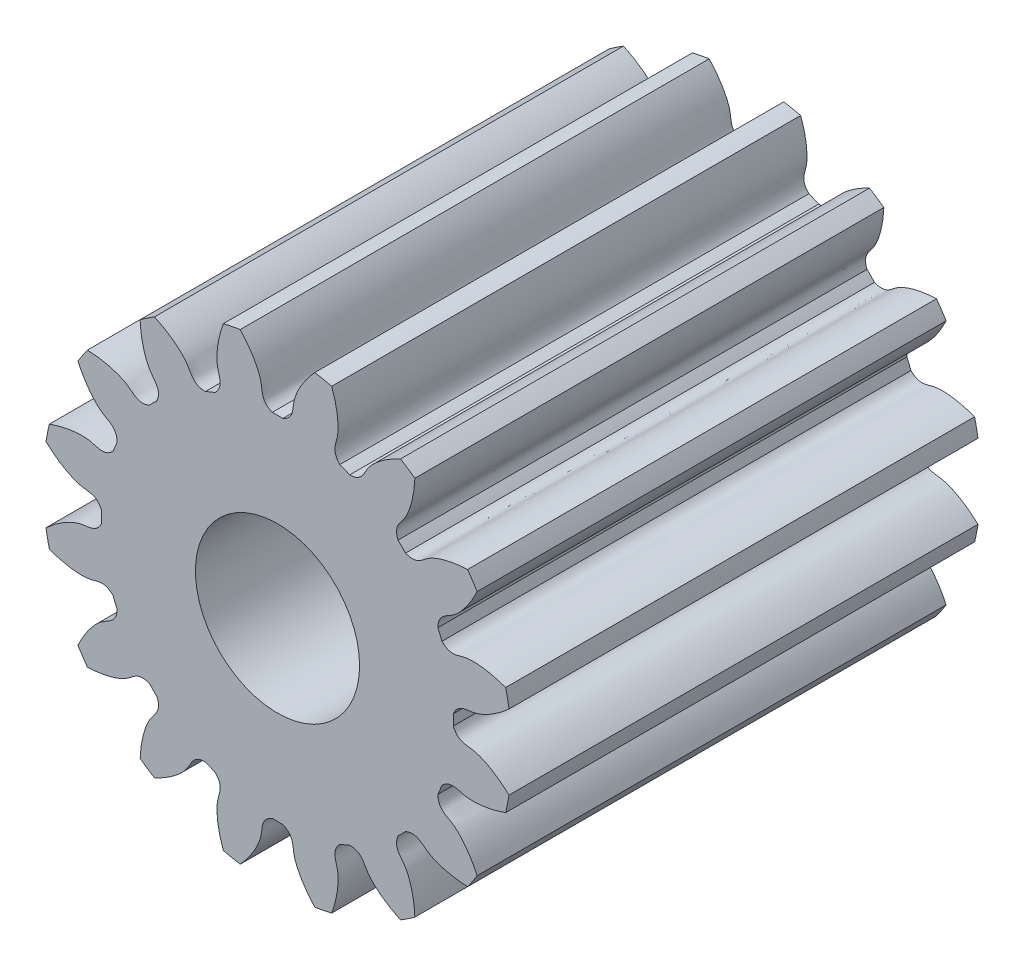
from build123d import *

# Parameters (mm, degrees)
SKETCH_1_R               = 4.5
EXTRUDE_1_DEPTH          = 9
CUT_EXTRUDE_1_DEPTH      = 12.022703843
PATTERN_CIRCULAR_1_COUNT = 16
SKETCH_4_R               = 1.575
CUT_EXTRUDE_2_DEPTH      = 10


with BuildPart() as part:
    # 草图1 → 凸台-拉伸1 (new body)
    with BuildSketch(Plane.XY):
        Circle(SKETCH_1_R)
    extrude(amount=EXTRUDE_1_DEPTH)

    # 草图2 → 切除-拉伸1 (cut, through all)
    with BuildSketch(Plane.XY):
        with BuildLine():
            ThreePointArc((0.101680395, 3.373467963), (0, 3.375), (-0.101680395, 3.373467963))
            add(Edge.make_bspline(
                [(-0.101680395, 3.373467963), (-0.320919735, 3.465061005), (-0.284660598, 3.635349809), (-0.322390644, 3.793404963), (-0.325601394, 3.80577545), (-0.329466049, 3.819526781), (-0.334039479, 3.834637453), (-0.339377888, 3.851083952), (-0.345536205, 3.868841182), (-0.352568839, 3.887882349), (-0.360529384, 3.908179024), (-0.369470654, 3.92970115), (-0.379444617, 3.952417062), (-0.390502356, 3.976293514), (-0.402694025, 4.001295699), (-0.416068812, 4.02738727), (-0.430674889, 4.054530373), (-0.446559381, 4.082685666), (-0.463768319, 4.111812348), (-0.482346604, 4.141868189), (-0.502337967, 4.172809557), (-0.523784931, 4.20459145), (-0.546728776, 4.237167525), (-0.571209498, 4.270490132), (-0.597265778, 4.304510345), (-0.624934946, 4.339177997), (-0.654252942, 4.374441713), (-0.685254293, 4.41024895), (-0.717972069, 4.446546028), (-0.752437861, 4.483278171), (-0.788681746, 4.520389541), (-0.826732258, 4.557823283), (-0.866616358, 4.595521557), (-0.90835941, 4.633425586), (-0.951985152, 4.67147569), (-0.99751567, 4.709611333), (-1.044971373, 4.747771162), (-1.094370973, 4.785893051), (-1.145731456, 4.823914147), (-1.199068069, 4.861770908), (-1.254394289, 4.899399156), (-1.311721817, 4.936734114), (-1.371060539, 4.97371046), (-1.453732402, 5.022959339), (-1.517494148, 5.058370721), (-1.560889991, 5.081371225)],
                knots=[0, 0, 0, 0, 0.200958108, 0.205848205, 0.211390316, 0.217584439, 0.224430575, 0.231928724, 0.240078886, 0.248881062, 0.25833525, 0.268441451, 0.279199665, 0.290609892, 0.302672132, 0.315386384, 0.32875265, 0.342770929, 0.357441221, 0.372763526, 0.388737843, 0.405364174, 0.422642518, 0.440572874, 0.459155244, 0.478389626, 0.498276022, 0.51881443, 0.540004852, 0.561847286, 0.584341734, 0.607488194, 0.631286667, 0.655737153, 0.680839653, 0.706594165, 0.73300069, 0.760059228, 0.787769779, 0.816132343, 0.84514692, 0.87481351, 0.905132113, 0.936102729, 1, 1, 1, 1], degree=3))
            ThreePointArc((-1.560889991, 5.081371225), (0, 5.315704195), (1.560889991, 5.081371225))
            add(Edge.make_bspline(
                [(0.101680395, 3.373467963), (0.320919735, 3.465061005), (0.284660598, 3.635349809), (0.322390644, 3.793404963), (0.325601394, 3.80577545), (0.329466049, 3.819526781), (0.334039479, 3.834637453), (0.339377888, 3.851083952), (0.345536205, 3.868841182), (0.352568839, 3.887882349), (0.360529384, 3.908179024), (0.369470654, 3.92970115), (0.379444617, 3.952417062), (0.390502356, 3.976293514), (0.402694025, 4.001295699), (0.416068812, 4.02738727), (0.430674889, 4.054530373), (0.446559381, 4.082685666), (0.463768319, 4.111812348), (0.482346604, 4.141868189), (0.502337967, 4.172809557), (0.523784931, 4.20459145), (0.546728776, 4.237167525), (0.571209498, 4.270490132), (0.597265778, 4.304510345), (0.624934946, 4.339177997), (0.654252942, 4.374441713), (0.685254293, 4.41024895), (0.717972069, 4.446546028), (0.752437861, 4.483278171), (0.788681746, 4.520389541), (0.826732258, 4.557823283), (0.866616358, 4.595521557), (0.90835941, 4.633425586), (0.951985152, 4.67147569), (0.99751567, 4.709611333), (1.044971373, 4.747771162), (1.094370973, 4.785893051), (1.145731456, 4.823914147), (1.199068069, 4.861770908), (1.254394289, 4.899399156), (1.311721817, 4.936734114), (1.371060539, 4.97371046), (1.453732402, 5.022959339), (1.517494148, 5.058370721), (1.560889991, 5.081371225)],
                knots=[0, 0, 0, 0, 0.200958108, 0.205848205, 0.211390316, 0.217584439, 0.224430575, 0.231928724, 0.240078886, 0.248881062, 0.25833525, 0.268441451, 0.279199665, 0.290609892, 0.302672132, 0.315386384, 0.32875265, 0.342770929, 0.357441221, 0.372763526, 0.388737843, 0.405364174, 0.422642518, 0.440572874, 0.459155244, 0.478389626, 0.498276022, 0.51881443, 0.540004852, 0.561847286, 0.584341734, 0.607488194, 0.631286667, 0.655737153, 0.680839653, 0.706594165, 0.73300069, 0.760059228, 0.787769779, 0.816132343, 0.84514692, 0.87481351, 0.905132113, 0.936102729, 1, 1, 1, 1], degree=3))
        make_face()
    cut_extrude_1 = extrude(amount=CUT_EXTRUDE_1_DEPTH, mode=Mode.SUBTRACT)

    # 阵列(圆周)1: 切除-拉伸1 ×16 about axis
    pattern_circular_1_axis = Axis((0, 0, 9), (0, 0, -1))
    for i in range(1, PATTERN_CIRCULAR_1_COUNT):
        add(cut_extrude_1.rotate(pattern_circular_1_axis, i * 360 / PATTERN_CIRCULAR_1_COUNT), mode=Mode.SUBTRACT)

    # 草图4 → 切除-拉伸2 (cut)
    with BuildSketch(Plane.XY.offset(9)):
        Circle(SKETCH_4_R)
    extrude(amount=-CUT_EXTRUDE_2_DEPTH, mode=Mode.SUBTRACT)


solid = part.part
